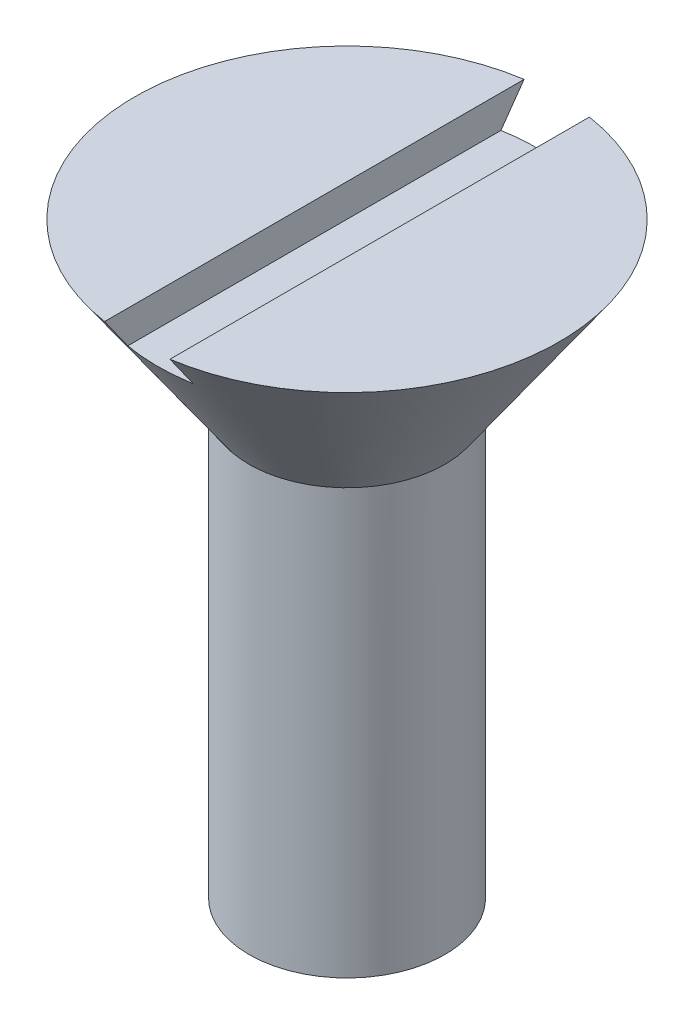
from build123d import *

# Parameters (mm, degrees)
CUT_EXTRUDE1_DEPTH = 1


with BuildPart() as part:
    # Sketch1 → Revolve5 (revolve)
    with BuildSketch(Plane.XY, mode=Mode.PRIVATE) as revolve5_sk:
        Polygon((6.5, 0), (3, -5), (3, -18), (0, -19.732050808), (0, 0), align=None)
    revolve(revolve5_sk.sketch.rotate(Axis((0, 0, 0), (0, 1, 0)), 90), axis=Axis((0, 0, 0), (0, 1, 0)))

    # Sketch2 → Cut-Extrude1 (cut)
    with BuildSketch(Plane(origin=(0, 0, 0), x_dir=(1, 0, 0), z_dir=(0, 1, 0))):
        with BuildLine():
            Line((0, -6.5), (0, 6.5))
            ThreePointArc((0, 6.5), (-0.501494825, 6.480625197), (-1, 6.422616289))
            Line((-1, 6.422616289), (-1, -6.422616289))
            ThreePointArc((-1, -6.422616289), (-0.501494825, -6.480625197), (0, -6.5))
        make_face()
        with BuildLine():
            ThreePointArc((1, 6.422616289), (0.501494825, 6.480625197), (0, 6.5))
            Line((0, 6.5), (0, -6.5))
            ThreePointArc((0, -6.5), (0.501494825, -6.480625197), (1, -6.422616289))
            Line((1, -6.422616289), (1, 6.422616289))
        make_face()
    extrude(amount=-CUT_EXTRUDE1_DEPTH, mode=Mode.SUBTRACT)


solid = part.part
